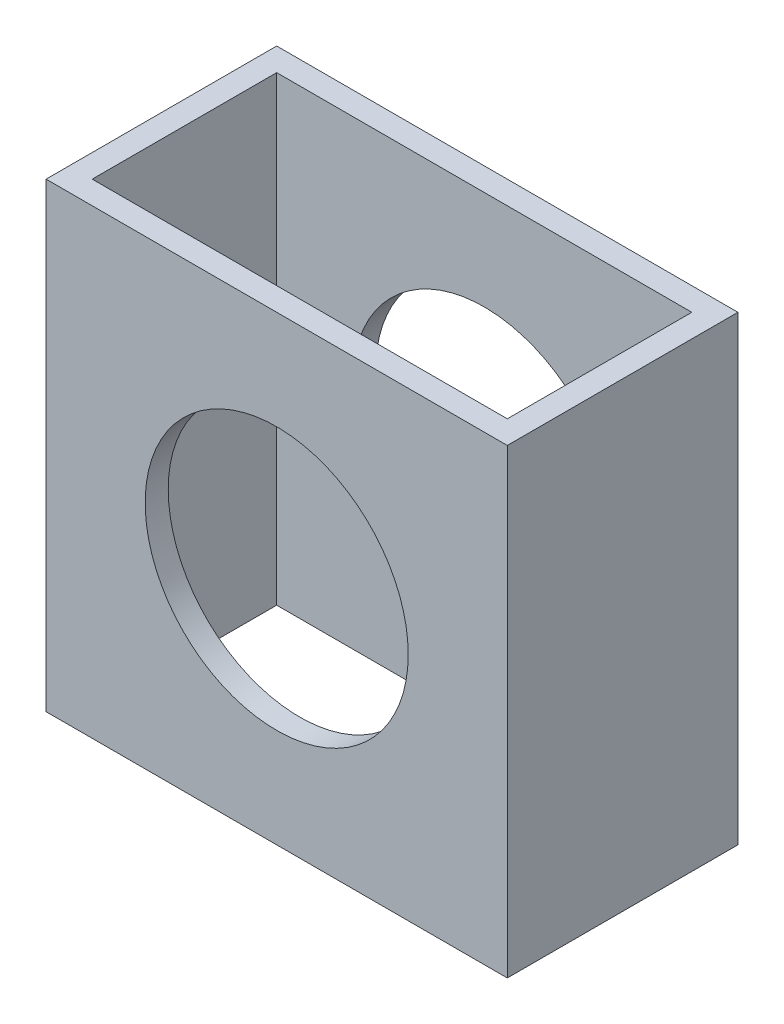
from build123d import *

# Parameters (mm, degrees)
SKETCH12_W                         = 25.4
SKETCH12_H                         = 50.8
SKETCH12_W_2                       = 20.32
SKETCH12_H_2                       = 45.72
RECTANGULAR_TUBE_2IN_X_1IN_1_DEPTH = 50.8
F_1_1_8_CLEARANCE_HOLE1_D          = 28.97124


with BuildPart() as part:
    # Sketch12 → Rectangular tube 2IN X 1IN(1) (new body)
    with BuildSketch(Plane(origin=(-25.4, 0, -12.7), x_dir=(0, 0, 1), z_dir=(0, 1, 0))):
        with Locations((12.7, 25.4)):
            Rectangle(SKETCH12_W, SKETCH12_H)
        with Locations((12.7, 25.4)):
            Rectangle(SKETCH12_W_2, SKETCH12_H_2, mode=Mode.SUBTRACT)
    extrude(amount=RECTANGULAR_TUBE_2IN_X_1IN_1_DEPTH)

    # 1-1/8 Clearance Hole1 (through all)
    with Locations(Plane.XY.offset(12.7)):
        with Locations((0, 25.4)):
            Hole(F_1_1_8_CLEARANCE_HOLE1_D / 2)


solid = part.part
